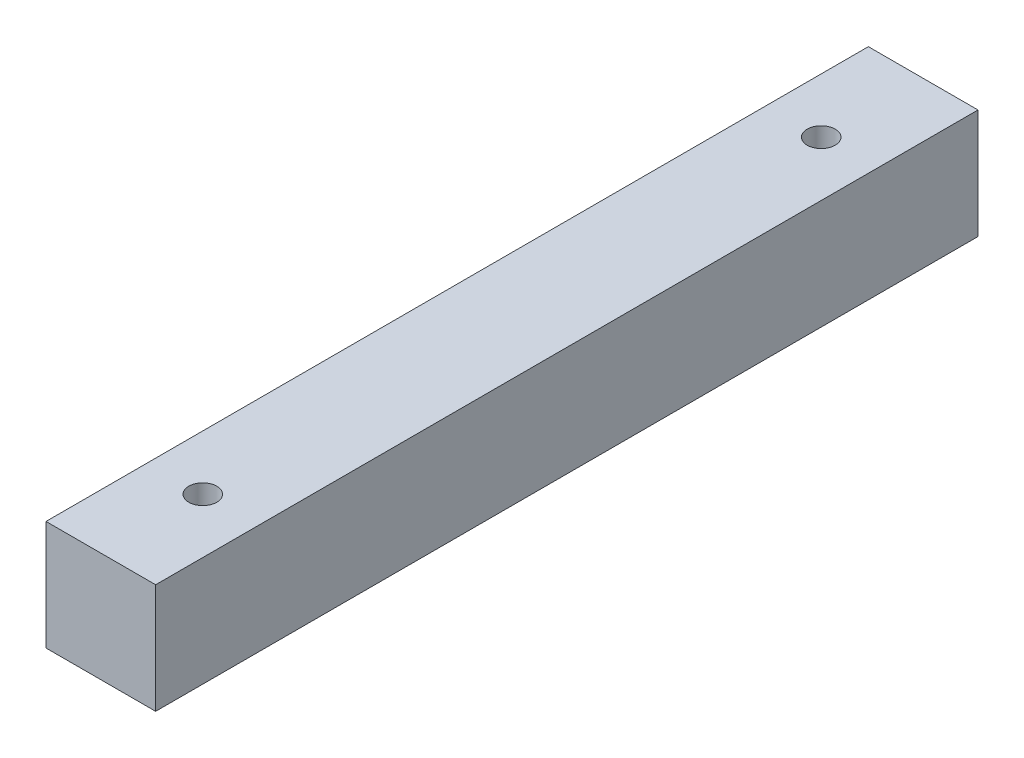
from build123d import *

# Parameters (mm, degrees)
SKETCH_1_W          = 20
SKETCH_1_H          = 20
EXTRUDE_1_DEPTH     = 150
SKETCH_2_R          = 2.55
CUT_EXTRUDE_1_DEPTH = 43


with BuildPart() as part:
    # 草图1 → 凸台-拉伸1 (new body)
    with BuildSketch(Plane.XY):
        Rectangle(SKETCH_1_W, SKETCH_1_H)
    extrude(amount=EXTRUDE_1_DEPTH)

    # 草图2 → 切除-拉伸1 (cut)
    with BuildSketch(Plane(origin=(0, 10, 0), x_dir=(1, 0, 0), z_dir=(0, 1, 0))):
        with Locations(Location((0, -131.4, 0), (0, 0, 270))):
            Circle(SKETCH_2_R)
        with Locations(Location((0, -18.6, 0), (0, 0, 270))):
            Circle(SKETCH_2_R)
    extrude(amount=-CUT_EXTRUDE_1_DEPTH, mode=Mode.SUBTRACT)


solid = part.part
